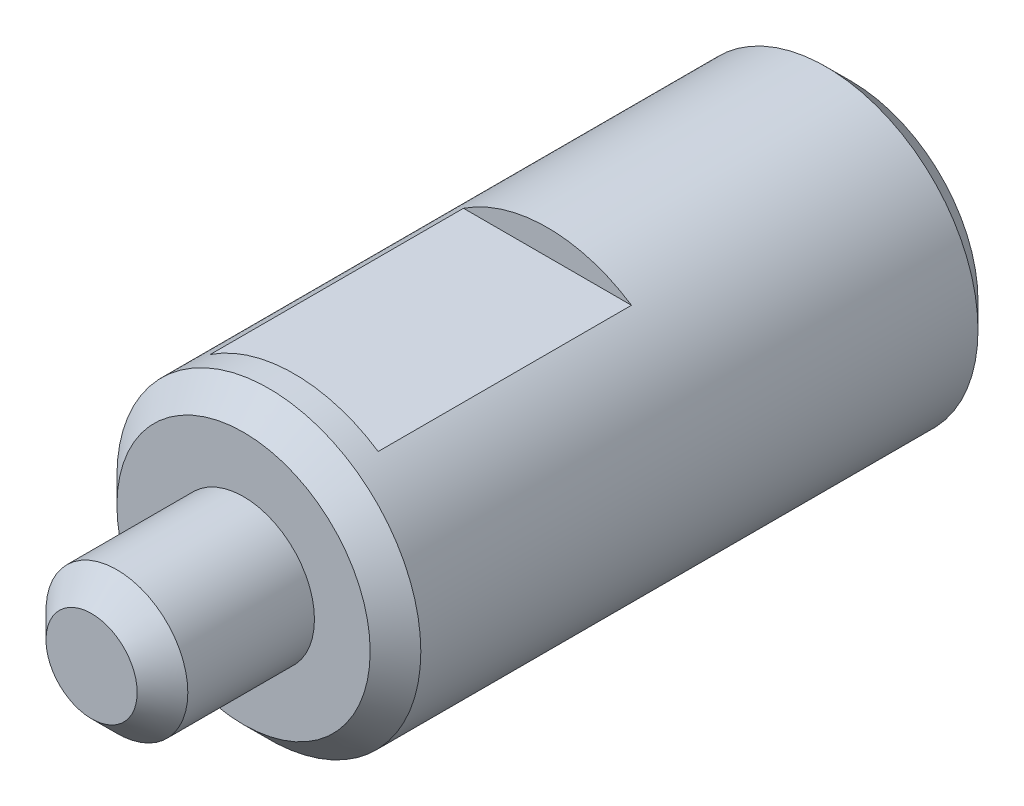
from build123d import *

# Parameters (mm, degrees)
SKETCH_1_R             = 3
EXTRUDE_1_DEPTH        = 12
SKETCH_2_R             = 1.4
EXTRUDE_2_DEPTH        = 3
CHAMFER_1_SIZE         = 0.5
HOLE_WIZARD_M3_1_D     = 2.5
HOLE_WIZARD_M3_1_DEPTH = 7.5
HOLE_WIZARD_M3_1_TIP   = 0.751075774
SKETCH_7_W             = 9.702446008
SKETCH_7_H             = 5
CUT_EXTRUDE_1_DEPTH    = 0.5


with BuildPart() as part:
    # 草图1 → 凸台-拉伸1 (new body)
    with BuildSketch(Plane.XY):
        Circle(SKETCH_1_R)
    extrude(amount=EXTRUDE_1_DEPTH)

    # 草图2 → 凸台-拉伸2 (add)
    with BuildSketch(Plane.XY.offset(12)):
        Circle(SKETCH_2_R)
    extrude(amount=EXTRUDE_2_DEPTH)

    # 倒角1
    chamfer_1_edges = [part.edges().sort_by_distance(p)[0] for p in [
        (-3, 0, 0),
        (-3, 0, 12),
        (-1.4, 0, 15),
    ]]
    chamfer(chamfer_1_edges, length=CHAMFER_1_SIZE)

    # M3 螺纹孔1
    with Locations(Plane(origin=(0, 0, 0), x_dir=(-1, 0, 0), z_dir=(0, 0, -1))):
        with Locations((0, 0)):
            Hole(HOLE_WIZARD_M3_1_D / 2, depth=HOLE_WIZARD_M3_1_DEPTH)
            with Locations((0, 0, -(HOLE_WIZARD_M3_1_DEPTH + HOLE_WIZARD_M3_1_TIP / 2))):  # 118° drill point
                Cone(0, HOLE_WIZARD_M3_1_D / 2, HOLE_WIZARD_M3_1_TIP, mode=Mode.SUBTRACT)

    # 草图7 → 切除-拉伸1 (cut)
    with BuildSketch(Plane(origin=(0, 3, 0), x_dir=(-1, 0, 0), z_dir=(0, 1, 0))):
        with Locations((0, 8.5)):
            Rectangle(SKETCH_7_W, SKETCH_7_H)
    cut_extrude_1 = extrude(amount=-CUT_EXTRUDE_1_DEPTH, mode=Mode.SUBTRACT)

    # 镜向1: 切除-拉伸1 across plane
    add(cut_extrude_1.mirror(Plane.ZX), mode=Mode.SUBTRACT)


solid = part.part
